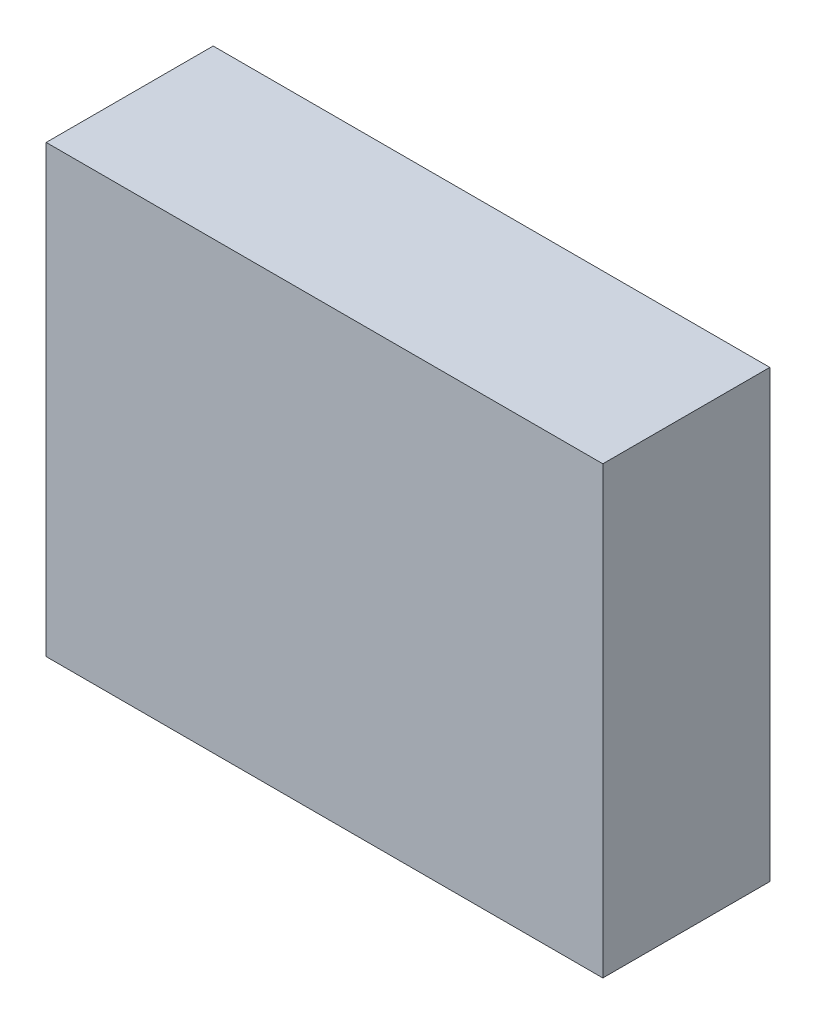
from build123d import *

# Parameters (mm, degrees)
SKETCH1_W           = 31.75
SKETCH1_H           = 25.4
BOSS_EXTRUDE1_DEPTH = 9.525


with BuildPart() as part:
    # Sketch1 → Boss-Extrude1 (new body)
    with BuildSketch(Plane.XY):
        Rectangle(SKETCH1_W, SKETCH1_H)
    extrude(amount=BOSS_EXTRUDE1_DEPTH)


solid = part.part
